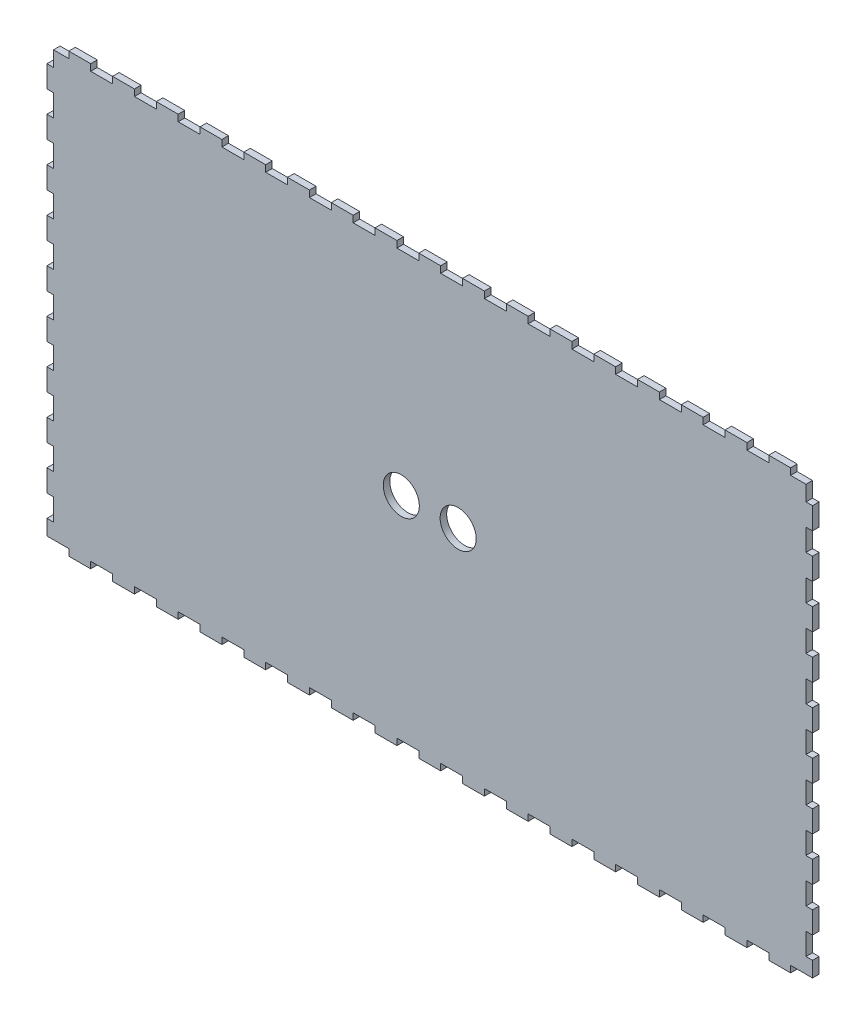
from build123d import *

# Parameters (mm, degrees)
CROQUIS1_R              = 8.25
SALIENTE_EXTRUIR1_DEPTH = 3


with BuildPart() as part:
    # Croquis1 → Saliente-Extruir1 (new body)
    with BuildSketch(Plane.XY):
        Polygon((-175, -97), (-165, -97), (-165, -100), (-155, -100), (-155, -97), (-145, -97), (-145, -100), (-135, -100), (-135, -97), (-125, -97), (-125, -100), (-115, -100), (-115, -97), (-105, -97), (-105, -100), (-95, -100), (-95, -97), (-85, -97), (-85, -100), (-75, -100), (-75, -97), (-65, -97), (-65, -100), (-55, -100), (-55, -97), (-45, -97), (-45, -100), (-35, -100), (-35, -97), (-25, -97), (-25, -100), (-15, -100), (-15, -97), (-5, -97), (-5, -100), (5, -100), (5, -97), (15, -97), (15, -100), (25, -100), (25, -97), (35, -97), (35, -100), (45, -100), (45, -97), (55, -97), (55, -100), (65, -100), (65, -97), (75, -97), (75, -100), (85, -100), (85, -97), (95, -97), (95, -100), (105, -100), (105, -97), (115, -97), (115, -100), (125, -100), (125, -97), (135, -97), (135, -100), (145, -100), (145, -97), (155, -97), (155, -100), (165, -100), (165, -97), (175, -97), (175, -90), (172, -90), (172, -80), (175, -80), (175, -70), (172, -70), (172, -60), (175, -60), (175, -50), (172, -50), (172, -40), (175, -40), (175, -30), (172, -30), (172, -20), (175, -20), (175, -10), (172, -10), (172, 0), (175, 0), (175, 10), (172, 10), (172, 20), (175, 20), (175, 30), (172, 30), (172, 40), (175, 40), (175, 50), (172, 50), (172, 60), (175, 60), (175, 70), (172, 70), (172, 80), (175, 80), (175, 90), (172, 90), (172, 97), (165, 97), (165, 100), (155, 100), (155, 97), (145, 97), (145, 100), (135, 100), (135, 97), (125, 97), (125, 100), (115, 100), (115, 97), (105, 97), (105, 100), (95, 100), (95, 97), (85, 97), (85, 100), (75, 100), (75, 97), (65, 97), (65, 100), (55, 100), (55, 97), (45, 97), (45, 100), (35, 100), (35, 97), (25, 97), (25, 100), (15, 100), (15, 97), (5, 97), (5, 100), (-5, 100), (-5, 97), (-15, 97), (-15, 100), (-25, 100), (-25, 97), (-35, 97), (-35, 100), (-45, 100), (-45, 97), (-55, 97), (-55, 100), (-65, 100), (-65, 97), (-75, 97), (-75, 100), (-85, 100), (-85, 97), (-95, 97), (-95, 100), (-105, 100), (-105, 97), (-115, 97), (-115, 100), (-125, 100), (-125, 97), (-135, 97), (-135, 100), (-145, 100), (-145, 97), (-155, 97), (-155, 100), (-165, 100), (-165, 97), (-172, 97), (-172, 90), (-175, 90), (-175, 80), (-172, 80), (-172, 70), (-175, 70), (-175, 60), (-172, 60), (-172, 50), (-175, 50), (-175, 40), (-172, 40), (-172, 30), (-175, 30), (-175, 20), (-172, 20), (-172, 10), (-175, 10), (-175, 0), (-172, 0), (-172, -10), (-175, -10), (-175, -20), (-172, -20), (-172, -30), (-175, -30), (-175, -40), (-172, -40), (-172, -50), (-175, -50), (-175, -60), (-172, -60), (-172, -70), (-175, -70), (-175, -80), (-172, -80), (-172, -90), (-175, -90), align=None)
        with Locations((-13, 0)):
            Circle(CROQUIS1_R, mode=Mode.SUBTRACT)
        with Locations((13, 0)):
            Circle(CROQUIS1_R, mode=Mode.SUBTRACT)
    extrude(amount=SALIENTE_EXTRUIR1_DEPTH)


solid = part.part
